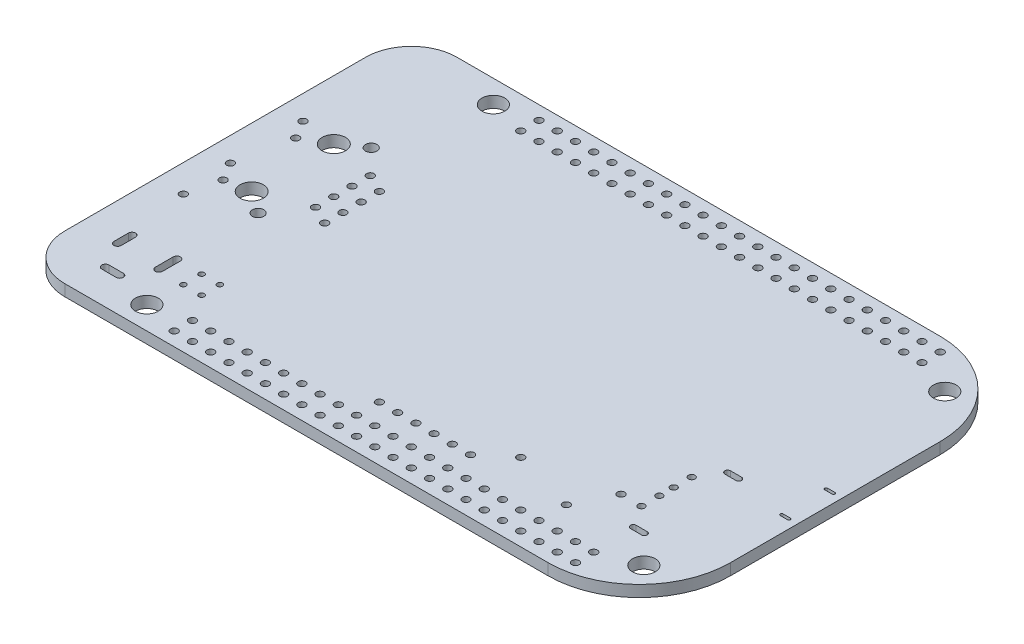
from build123d import *

# Parameters (mm, degrees)
SKETCH2_W                         = 86.36
SKETCH2_H                         = 54.61
MAIN_BOARD_DEPTH                  = 0.79375
SKETCH3_R                         = 1.5875
BOARD_MOUNTING_HOLES_DEPTH        = 52.113555748
SKETCH4_R                         = 0.508
SKETCH4_R_2                       = 0.8001
SKETCH4_R_3                       = 1.6256
P5_ETHERNET_CONNECTOR_HOLES_DEPTH = 52.113555748
SKETCH5_R                         = 0.45999908
P3_USB_HOST_DEPTH                 = 52.113555748
P6_HDMI_DEPTH                     = 52.113555748
SKETCH7_R                         = 0.50999898
P9_IDC_EXPANSION_PORT_DEPTH       = 52.113555748
SKETCH8_R                         = 0.50999898
P8_IDC_EXPANSION_PORT_DEPTH       = 52.113555748
SKETCH9_R                         = 0.508
TP1_TEST_POINT_1_DEPTH            = 52.113555748
SKETCH10_R                        = 0.508
TP4_TEST_POINT_4_DEPTH            = 52.113555748
SKETCH11_R                        = 0.508
RT1_CAPACITOR_DEPTH               = 52.113555748
SKETCH12_R                        = 0.508
J1_DEBUG_PORT_DEPTH               = 52.113555748
P1_POWER_PLUG_DEPTH               = 52.113555748
SKETCH14_R                        = 0.381
TP6_BATTERY_DEPTH                 = 52.113555748
SKETCH15_R                        = 0.381
TP8_BATTERY_DEPTH                 = 52.113555748
SKETCH16_R                        = 0.381
TP5_BATTERY_DEPTH                 = 52.113555748
SKETCH18_R                        = 0.381
TP7_BATTERY_DEPTH                 = 52.113555748
FILLET1_R                         = 6.35
FILLET2_R                         = 12.7


with BuildPart() as part:
    # Sketch2 → Main Board (new, symmetric)
    with BuildSketch(Plane(origin=(0, 0, 0), x_dir=(1, 0, 0), z_dir=(0, 1, 0))):
        Rectangle(SKETCH2_W, SKETCH2_H)
    extrude(amount=MAIN_BOARD_DEPTH, both=True)

    # Sketch3 → Board Mounting Holes (cut, through all)
    with BuildSketch(Plane.XZ.offset(0.79375)):
        with Locations(Location((37.465, 20.955, 0), (0, 0, 270))):
            Circle(SKETCH3_R)
        with Locations(Location((37.465, -20.955, 0), (0, 0, 270))):
            Circle(SKETCH3_R)
        with Locations(Location((-28.575, -24.13, 0), (0, 0, 270))):
            Circle(SKETCH3_R)
        with Locations(Location((-28.575, 24.13, 0), (0, 0, 270))):
            Circle(SKETCH3_R)
    extrude(amount=-BOARD_MOUNTING_HOLES_DEPTH, mode=Mode.SUBTRACT)

    # Sketch4 → P5 - Ethernet Connector Holes (cut, through all)
    with BuildSketch(Plane.XZ.offset(0.79375)):
        with Locations(Location((-38.3032, 3.7846, 0), (0, 0, 270))):
            Circle(SKETCH4_R)
        with Locations(Location((-39.8272, 1.2446, 0), (0, 0, 270))):
            Circle(SKETCH4_R)
        with Locations(Location((-38.3032, -6.3246, 0), (0, 0, 270))):
            Circle(SKETCH4_R)
        with Locations(Location((-39.8272, -8.8646, 0), (0, 0, 270))):
            Circle(SKETCH4_R)
        with Locations(Location((-28.575, -6.985, 0), (0, 0, 270))):
            Circle(SKETCH4_R)
        with Locations(Location((-28.575, -4.445, 0), (0, 0, 270))):
            Circle(SKETCH4_R)
        with Locations(Location((-28.575, -1.905, 0), (0, 0, 270))):
            Circle(SKETCH4_R)
        with Locations(Location((-28.575, 0.635, 0), (0, 0, 270))):
            Circle(SKETCH4_R)
        with Locations(Location((-26.035, 1.905, 0), (0, 0, 270))):
            Circle(SKETCH4_R)
        with Locations(Location((-26.035, -0.635, 0), (0, 0, 270))):
            Circle(SKETCH4_R)
        with Locations(Location((-26.035, -3.175, 0), (0, 0, 270))):
            Circle(SKETCH4_R)
        with Locations(Location((-26.035, -5.715, 0), (0, 0, 270))):
            Circle(SKETCH4_R)
        with Locations(Location((-31.877, 5.334, 0), (0, 0, 270))):
            Circle(SKETCH4_R_2)
        with Locations(Location((-34.925, 3.175, 0), (0, 0, 270))):
            Circle(SKETCH4_R_3)
        with Locations(Location((-34.925, -8.255, 0), (0, 0, 270))):
            Circle(SKETCH4_R_3)
        with Locations(Location((-31.877, -10.414, 0), (0, 0, 270))):
            Circle(SKETCH4_R_2)
    extrude(amount=-P5_ETHERNET_CONNECTOR_HOLES_DEPTH, mode=Mode.SUBTRACT)

    # Sketch5 → P3 - USB Host (cut, through all)
    with BuildSketch(Plane.XZ.offset(0.79375)):
        with Locations(Location((30.16019114, 13.98778, 0), (0, 0, 270))):
            Circle(SKETCH5_R)
        with Locations(Location((30.16019114, 11.48842, 0), (0, 0, 270))):
            Circle(SKETCH5_R)
        with Locations(Location((30.16019114, 9.4869, 0), (0, 0, 270))):
            Circle(SKETCH5_R)
        with Locations(Location((30.16019114, 6.98754, 0), (0, 0, 270))):
            Circle(SKETCH5_R)
        with BuildLine():
            Line((32.10037014, 17.45453456), (33.64037214, 17.45453456))
            ThreePointArc((33.64037214, 17.45453456), (34.03724714, 17.05765956), (33.64037214, 16.66078456))
            Line((33.64037214, 16.66078456), (32.10037014, 16.66078456))
            ThreePointArc((32.10037014, 16.66078456), (31.70349514, 17.05765956), (32.10037014, 17.45453456))
        make_face()
        with BuildLine():
            Line((32.10037014, 4.31453544), (33.64037214, 4.31453544))
            ThreePointArc((33.64037214, 4.31453544), (34.03724714, 3.91766044), (33.64037214, 3.52078544))
            Line((33.64037214, 3.52078544), (32.10037014, 3.52078544))
            ThreePointArc((32.10037014, 3.52078544), (31.70349514, 3.91766044), (32.10037014, 4.31453544))
        make_face()
    extrude(amount=-P3_USB_HOST_DEPTH, mode=Mode.SUBTRACT)

    # Sketch6 → P6 - HDMI (cut, through all)
    with BuildSketch(Plane.XZ.offset(0.79375)):
        with BuildLine():
            Line((40.962072, 5.4575075), (41.978072, 5.4575075))
            ThreePointArc((41.978072, 5.4575075), (42.1765095, 5.25907), (41.978072, 5.0606325))
            Line((41.978072, 5.0606325), (40.962072, 5.0606325))
            ThreePointArc((40.962072, 5.0606325), (40.7636345, 5.25907), (40.962072, 5.4575075))
        make_face()
        with BuildLine():
            Line((40.962072, -0.7426325), (41.978072, -0.7426325))
            ThreePointArc((41.978072, -0.7426325), (42.1765095, -0.94107), (41.978072, -1.1395075))
            Line((41.978072, -1.1395075), (40.962072, -1.1395075))
            ThreePointArc((40.962072, -1.1395075), (40.7636345, -0.94107), (40.962072, -0.7426325))
        make_face()
    extrude(amount=-P6_HDMI_DEPTH, mode=Mode.SUBTRACT)

    # Sketch7 → P9 - IDC Expansion Port (cut, through all)
    with BuildSketch(Plane.XZ.offset(0.79375)):
        with Locations(Location((32.385, 25.4, 0), (0, 0, 270))):
            Circle(SKETCH7_R)
        with Locations(Location((29.845, 25.4, 0), (0, 0, 270))):
            Circle(SKETCH7_R)
        with Locations(Location((27.305, 25.4, 0), (0, 0, 270))):
            Circle(SKETCH7_R)
        with Locations(Location((24.765, 25.4, 0), (0, 0, 270))):
            Circle(SKETCH7_R)
        with Locations(Location((22.225, 25.4, 0), (0, 0, 270))):
            Circle(SKETCH7_R)
        with Locations(Location((19.685, 25.4, 0), (0, 0, 270))):
            Circle(SKETCH7_R)
        with Locations(Location((17.145, 25.4, 0), (0, 0, 270))):
            Circle(SKETCH7_R)
        with Locations(Location((14.605, 25.4, 0), (0, 0, 270))):
            Circle(SKETCH7_R)
        with Locations(Location((12.065, 25.4, 0), (0, 0, 270))):
            Circle(SKETCH7_R)
        with Locations(Location((9.525, 25.4, 0), (0, 0, 270))):
            Circle(SKETCH7_R)
        with Locations(Location((6.985, 25.4, 0), (0, 0, 270))):
            Circle(SKETCH7_R)
        with Locations(Location((4.445, 25.4, 0), (0, 0, 270))):
            Circle(SKETCH7_R)
        with Locations(Location((1.905, 25.4, 0), (0, 0, 270))):
            Circle(SKETCH7_R)
        with Locations(Location((-0.635, 25.4, 0), (0, 0, 270))):
            Circle(SKETCH7_R)
        with Locations(Location((-3.175, 25.4, 0), (0, 0, 270))):
            Circle(SKETCH7_R)
        with Locations(Location((-5.715, 25.4, 0), (0, 0, 270))):
            Circle(SKETCH7_R)
        with Locations(Location((-8.255, 25.4, 0), (0, 0, 270))):
            Circle(SKETCH7_R)
        with Locations(Location((-10.795, 25.4, 0), (0, 0, 270))):
            Circle(SKETCH7_R)
        with Locations(Location((-13.335, 25.4, 0), (0, 0, 270))):
            Circle(SKETCH7_R)
        with Locations(Location((-15.875, 25.4, 0), (0, 0, 270))):
            Circle(SKETCH7_R)
        with Locations(Location((-18.415, 25.4, 0), (0, 0, 270))):
            Circle(SKETCH7_R)
        with Locations(Location((-20.955, 25.4, 0), (0, 0, 270))):
            Circle(SKETCH7_R)
        with Locations(Location((-23.495, 25.4, 0), (0, 0, 270))):
            Circle(SKETCH7_R)
        with Locations(Location((29.845, 22.86, 0), (0, 0, 270))):
            Circle(SKETCH7_R)
        with Locations(Location((27.305, 22.86, 0), (0, 0, 270))):
            Circle(SKETCH7_R)
        with Locations(Location((24.765, 22.86, 0), (0, 0, 270))):
            Circle(SKETCH7_R)
        with Locations(Location((22.225, 22.86, 0), (0, 0, 270))):
            Circle(SKETCH7_R)
        with Locations(Location((19.685, 22.86, 0), (0, 0, 270))):
            Circle(SKETCH7_R)
        with Locations(Location((17.145, 22.86, 0), (0, 0, 270))):
            Circle(SKETCH7_R)
        with Locations(Location((14.605, 22.86, 0), (0, 0, 270))):
            Circle(SKETCH7_R)
        with Locations(Location((12.065, 22.86, 0), (0, 0, 270))):
            Circle(SKETCH7_R)
        with Locations(Location((9.525, 22.86, 0), (0, 0, 270))):
            Circle(SKETCH7_R)
        with Locations(Location((6.985, 22.86, 0), (0, 0, 270))):
            Circle(SKETCH7_R)
        with Locations(Location((4.445, 22.86, 0), (0, 0, 270))):
            Circle(SKETCH7_R)
        with Locations(Location((1.905, 22.86, 0), (0, 0, 270))):
            Circle(SKETCH7_R)
        with Locations(Location((-0.635, 22.86, 0), (0, 0, 270))):
            Circle(SKETCH7_R)
        with Locations(Location((-3.175, 22.86, 0), (0, 0, 270))):
            Circle(SKETCH7_R)
        with Locations(Location((-5.715, 22.86, 0), (0, 0, 270))):
            Circle(SKETCH7_R)
        with Locations(Location((-8.255, 22.86, 0), (0, 0, 270))):
            Circle(SKETCH7_R)
        with Locations(Location((-10.795, 22.86, 0), (0, 0, 270))):
            Circle(SKETCH7_R)
        with Locations(Location((-13.335, 22.86, 0), (0, 0, 270))):
            Circle(SKETCH7_R)
        with Locations(Location((-15.875, 22.86, 0), (0, 0, 270))):
            Circle(SKETCH7_R)
        with Locations(Location((-18.415, 22.86, 0), (0, 0, 270))):
            Circle(SKETCH7_R)
        with Locations(Location((-20.955, 22.86, 0), (0, 0, 270))):
            Circle(SKETCH7_R)
        with Locations(Location((-23.495, 22.86, 0), (0, 0, 270))):
            Circle(SKETCH7_R)
        with Locations(Location((32.385, 22.86, 0), (0, 0, 270))):
            Circle(SKETCH7_R)
    extrude(amount=-P9_IDC_EXPANSION_PORT_DEPTH, mode=Mode.SUBTRACT)

    # Sketch8 → P8 - IDC Expansion Port (cut, through all)
    with BuildSketch(Plane.XZ.offset(0.79375)):
        with Locations(Location((32.385, -22.86, 0), (0, 0, 270))):
            Circle(SKETCH8_R)
        with Locations(Location((29.845, -22.86, 0), (0, 0, 270))):
            Circle(SKETCH8_R)
        with Locations(Location((27.305, -22.86, 0), (0, 0, 270))):
            Circle(SKETCH8_R)
        with Locations(Location((24.765, -22.86, 0), (0, 0, 270))):
            Circle(SKETCH8_R)
        with Locations(Location((22.225, -22.86, 0), (0, 0, 270))):
            Circle(SKETCH8_R)
        with Locations(Location((19.685, -22.86, 0), (0, 0, 270))):
            Circle(SKETCH8_R)
        with Locations(Location((17.145, -22.86, 0), (0, 0, 270))):
            Circle(SKETCH8_R)
        with Locations(Location((14.605, -22.86, 0), (0, 0, 270))):
            Circle(SKETCH8_R)
        with Locations(Location((12.065, -22.86, 0), (0, 0, 270))):
            Circle(SKETCH8_R)
        with Locations(Location((9.525, -22.86, 0), (0, 0, 270))):
            Circle(SKETCH8_R)
        with Locations(Location((6.985, -22.86, 0), (0, 0, 270))):
            Circle(SKETCH8_R)
        with Locations(Location((4.445, -22.86, 0), (0, 0, 270))):
            Circle(SKETCH8_R)
        with Locations(Location((1.905, -22.86, 0), (0, 0, 270))):
            Circle(SKETCH8_R)
        with Locations(Location((-0.635, -22.86, 0), (0, 0, 270))):
            Circle(SKETCH8_R)
        with Locations(Location((-3.175, -22.86, 0), (0, 0, 270))):
            Circle(SKETCH8_R)
        with Locations(Location((-5.715, -22.86, 0), (0, 0, 270))):
            Circle(SKETCH8_R)
        with Locations(Location((-8.255, -22.86, 0), (0, 0, 270))):
            Circle(SKETCH8_R)
        with Locations(Location((-10.795, -22.86, 0), (0, 0, 270))):
            Circle(SKETCH8_R)
        with Locations(Location((-13.335, -22.86, 0), (0, 0, 270))):
            Circle(SKETCH8_R)
        with Locations(Location((-15.875, -22.86, 0), (0, 0, 270))):
            Circle(SKETCH8_R)
        with Locations(Location((-18.415, -22.86, 0), (0, 0, 270))):
            Circle(SKETCH8_R)
        with Locations(Location((-20.955, -22.86, 0), (0, 0, 270))):
            Circle(SKETCH8_R)
        with Locations(Location((-23.495, -22.86, 0), (0, 0, 270))):
            Circle(SKETCH8_R)
        with Locations(Location((29.845, -25.4, 0), (0, 0, 270))):
            Circle(SKETCH8_R)
        with Locations(Location((27.305, -25.4, 0), (0, 0, 270))):
            Circle(SKETCH8_R)
        with Locations(Location((24.765, -25.4, 0), (0, 0, 270))):
            Circle(SKETCH8_R)
        with Locations(Location((22.225, -25.4, 0), (0, 0, 270))):
            Circle(SKETCH8_R)
        with Locations(Location((19.685, -25.4, 0), (0, 0, 270))):
            Circle(SKETCH8_R)
        with Locations(Location((17.145, -25.4, 0), (0, 0, 270))):
            Circle(SKETCH8_R)
        with Locations(Location((14.605, -25.4, 0), (0, 0, 270))):
            Circle(SKETCH8_R)
        with Locations(Location((12.065, -25.4, 0), (0, 0, 270))):
            Circle(SKETCH8_R)
        with Locations(Location((9.525, -25.4, 0), (0, 0, 270))):
            Circle(SKETCH8_R)
        with Locations(Location((6.985, -25.4, 0), (0, 0, 270))):
            Circle(SKETCH8_R)
        with Locations(Location((4.445, -25.4, 0), (0, 0, 270))):
            Circle(SKETCH8_R)
        with Locations(Location((1.905, -25.4, 0), (0, 0, 270))):
            Circle(SKETCH8_R)
        with Locations(Location((-0.635, -25.4, 0), (0, 0, 270))):
            Circle(SKETCH8_R)
        with Locations(Location((-3.175, -25.4, 0), (0, 0, 270))):
            Circle(SKETCH8_R)
        with Locations(Location((-5.715, -25.4, 0), (0, 0, 270))):
            Circle(SKETCH8_R)
        with Locations(Location((-8.255, -25.4, 0), (0, 0, 270))):
            Circle(SKETCH8_R)
        with Locations(Location((-10.795, -25.4, 0), (0, 0, 270))):
            Circle(SKETCH8_R)
        with Locations(Location((-13.335, -25.4, 0), (0, 0, 270))):
            Circle(SKETCH8_R)
        with Locations(Location((-15.875, -25.4, 0), (0, 0, 270))):
            Circle(SKETCH8_R)
        with Locations(Location((-18.415, -25.4, 0), (0, 0, 270))):
            Circle(SKETCH8_R)
        with Locations(Location((-20.955, -25.4, 0), (0, 0, 270))):
            Circle(SKETCH8_R)
        with Locations(Location((-23.495, -25.4, 0), (0, 0, 270))):
            Circle(SKETCH8_R)
        with Locations(Location((32.385, -25.4, 0), (0, 0, 270))):
            Circle(SKETCH8_R)
    extrude(amount=-P8_IDC_EXPANSION_PORT_DEPTH, mode=Mode.SUBTRACT)

    # Sketch9 → TP1 - Test Point 1 (cut, through all)
    with BuildSketch(Plane.XZ.offset(0.79375)):
        with Locations(Location((15.875, 16.51, 0), (0, 0, 270))):
            Circle(SKETCH9_R)
    extrude(amount=-TP1_TEST_POINT_1_DEPTH, mode=Mode.SUBTRACT)

    # Sketch10 → TP4 - Test Point 4 (cut, through all)
    with BuildSketch(Plane.XZ.offset(0.79375)):
        with Locations(Location((-39.37, 8.255, 0), (0, 0, 270))):
            Circle(SKETCH10_R)
    extrude(amount=-TP4_TEST_POINT_4_DEPTH, mode=Mode.SUBTRACT)

    # Sketch11 → RT1 - Capacitor (cut, through all)
    with BuildSketch(Plane.XZ.offset(0.79375)):
        with Locations(Location((27.305, 13.97, 0), (0, 0, 270))):
            Circle(SKETCH11_R)
        with Locations(Location((24.765, 19.05, 0), (0, 0, 270))):
            Circle(SKETCH11_R)
    extrude(amount=-RT1_CAPACITOR_DEPTH, mode=Mode.SUBTRACT)

    # Sketch12 → J1 - Debug Port (cut, through all)
    with BuildSketch(Plane.XZ.offset(0.79375)):
        with Locations(Location((12.065, 19.685, 0), (0, 0, 270))):
            Circle(SKETCH12_R)
        with Locations(Location((9.525, 19.685, 0), (0, 0, 270))):
            Circle(SKETCH12_R)
        with Locations(Location((6.985, 19.685, 0), (0, 0, 270))):
            Circle(SKETCH12_R)
        with Locations(Location((4.445, 19.685, 0), (0, 0, 270))):
            Circle(SKETCH12_R)
        with Locations(Location((1.905, 19.685, 0), (0, 0, 270))):
            Circle(SKETCH12_R)
        with Locations(Location((-0.635, 19.685, 0), (0, 0, 270))):
            Circle(SKETCH12_R)
    extrude(amount=-J1_DEBUG_PORT_DEPTH, mode=Mode.SUBTRACT)

    # Sketch13 → P1 - Power Plug (cut, through all)
    with BuildSketch(Plane.XZ.offset(0.79375)):
        with BuildLine():
            Line((-31.50362, 19.03000004), (-31.50362, 16.52999996))
            ThreePointArc((-31.50362, 16.52999996), (-32.004, 16.02961996), (-32.50438, 16.52999996))
            Line((-32.50438, 16.52999996), (-32.50438, 19.03000004))
            ThreePointArc((-32.50438, 19.03000004), (-32.004, 19.53038004), (-31.50362, 19.03000004))
        make_face()
        with BuildLine():
            Line((-38.498399, 16.77999946), (-38.498399, 18.78000054))
            ThreePointArc((-38.498399, 18.78000054), (-37.9984, 19.27999954), (-37.498401, 18.78000054))
            Line((-37.498401, 18.78000054), (-37.498401, 16.77999946))
            ThreePointArc((-37.498401, 16.77999946), (-37.9984, 16.28000046), (-38.498399, 16.77999946))
        make_face()
        with BuildLine():
            Line((-36.00120054, 22.97938), (-34.00119946, 22.97938))
            ThreePointArc((-34.00119946, 22.97938), (-33.50081946, 22.479), (-34.00119946, 21.97862))
            Line((-34.00119946, 21.97862), (-36.00120054, 21.97862))
            ThreePointArc((-36.00120054, 21.97862), (-36.50158054, 22.479), (-36.00120054, 22.97938))
        make_face()
    extrude(amount=-P1_POWER_PLUG_DEPTH, mode=Mode.SUBTRACT)

    # Sketch14 → TP6 - BATTERY (cut, through all)
    with BuildSketch(Plane.XZ.offset(0.79375)):
        with Locations(Location((-28.448, 19.177, 0), (0, 0, 270))):
            Circle(SKETCH14_R)
    extrude(amount=-TP6_BATTERY_DEPTH, mode=Mode.SUBTRACT)

    # Sketch15 → TP8 - BATTERY (cut, through all)
    with BuildSketch(Plane.XZ.offset(0.79375)):
        with Locations(Location((-25.908, 19.177, 0), (0, 0, 270))):
            Circle(SKETCH15_R)
    extrude(amount=-TP8_BATTERY_DEPTH, mode=Mode.SUBTRACT)

    # Sketch16 → TP5 - BATTERY (cut, through all)
    with BuildSketch(Plane.XZ.offset(0.79375)):
        with Locations(Location((-28.448, 16.637, 0), (0, 0, 270))):
            Circle(SKETCH16_R)
    extrude(amount=-TP5_BATTERY_DEPTH, mode=Mode.SUBTRACT)

    # Sketch18 → TP7 - BATTERY (cut, through all)
    with BuildSketch(Plane.XZ.offset(0.79375)):
        with Locations(Location((-25.908, 16.637, 0), (0, 0, 270))):
            Circle(SKETCH18_R)
    extrude(amount=-TP7_BATTERY_DEPTH, mode=Mode.SUBTRACT)

    # Fillet1
    fillet1_edges = [part.edges().sort_by_distance(p)[0] for p in [
        (-43.18, 0, 27.305),
        (-43.18, 0, -27.305),
    ]]
    fillet(fillet1_edges, radius=FILLET1_R)

    # Fillet2
    fillet2_edges = [part.edges().sort_by_distance(p)[0] for p in [
        (43.18, 0, 27.305),
        (43.18, 0, -27.305),
    ]]
    fillet(fillet2_edges, radius=FILLET2_R)


solid = part.part
